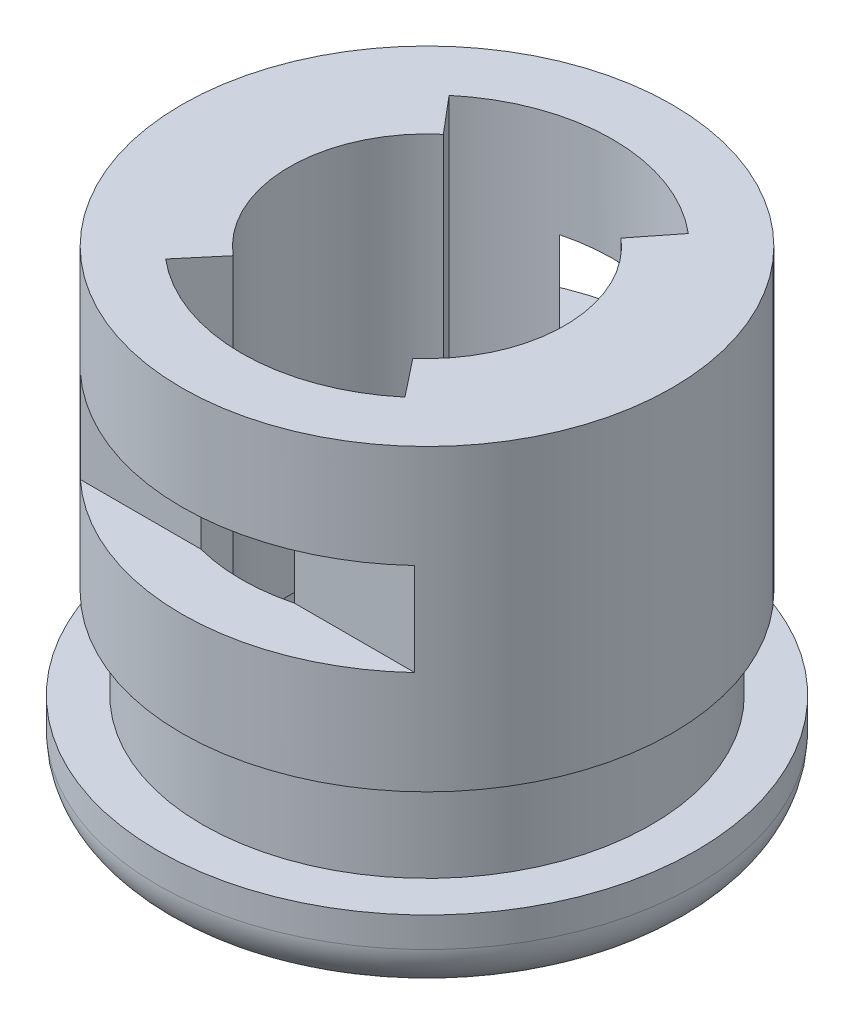
from build123d import *

# Parameters (mm, degrees)
CROQUIS1_R                 = 4.5
SALIENTE_EXTRUIR1_DEPTH    = 1.3
CROQUIS2_R                 = 3.75
SALIENTE_EXTRUIR2_DEPTH    = 1.5
CROQUIS3_R                 = 4.1
SALIENTE_EXTRUIR3_DEPTH    = 5
CORTAR_EXTRUIR3_DEPTH      = 6.2
CORTAR_EXTRUIR4_DEPTH      = 1.8
REDONDEO1_R                = 0.8
CORTAR_EXTRUIR5_DEPTH      = 11.066777041
CORTAR_EXTRUIR5_DEPTH_BACK = 11.066777041
CROQUIS8_W                 = 1.1
CROQUIS8_H                 = 1.55


with BuildPart() as part:
    # Croquis1 → Saliente-Extruir1 (new body)
    with BuildSketch(Plane(origin=(0, 0, 0), x_dir=(1, 0, 0), z_dir=(0, 1, 0))):
        with Locations(Location((0, 0, 0), (0, 0, 270))):
            Circle(CROQUIS1_R)
    extrude(amount=SALIENTE_EXTRUIR1_DEPTH)

    # Croquis2 → Saliente-Extruir2 (add)
    with BuildSketch(Plane(origin=(0, 1.3, 0), x_dir=(1, 0, 0), z_dir=(0, 1, 0))):
        with Locations(Location((0, 0, 0), (0, 0, 270))):
            Circle(CROQUIS2_R)
    extrude(amount=SALIENTE_EXTRUIR2_DEPTH)

    # Croquis3 → Saliente-Extruir3 (add)
    with BuildSketch(Plane(origin=(0, 2.8, 0), x_dir=(1, 0, 0), z_dir=(0, 1, 0))):
        with Locations(Location((0, 0, 0), (0, 0, 270))):
            Circle(CROQUIS3_R)
    extrude(amount=SALIENTE_EXTRUIR3_DEPTH)

    # Croquis4 → Cortar-Extruir3 (cut)
    with BuildSketch(Plane(origin=(0, 7.8, 0), x_dir=(1, 0, 0), z_dir=(0, 1, 0))):
        with BuildLine():
            Line((-2, 2.368543856), (-1.483870968, 1.757306732))
            ThreePointArc((-1.483870968, 1.757306732), (-2.3, 0), (-1.483870968, -1.757306732))
            Line((-1.483870968, -1.757306732), (-2, -2.368543856))
            ThreePointArc((-2, -2.368543856), (0, -3.1), (2, -2.368543856))
            Line((2, -2.368543856), (1.503663664, -1.740400984))
            ThreePointArc((1.503663664, -1.740400984), (2.3, 0), (1.503663664, 1.740400984))
            Line((1.503663664, 1.740400984), (2, 2.368543856))
            ThreePointArc((2, 2.368543856), (0, 3.1), (-2, 2.368543856))
        make_face()
    extrude(amount=-CORTAR_EXTRUIR3_DEPTH, mode=Mode.SUBTRACT)

    # Croquis7 → Cortar-Extruir4 (cut)
    with BuildSketch(Plane(origin=(0, 1.6, 0), x_dir=(1, 0, 0), z_dir=(0, 1, 0))):
        with BuildLine():
            Line((1.642406771, 1.75), (1.642406771, -1.75))
            ThreePointArc((1.642406771, -1.75), (1.157326995, -2.102520922), (0.6, -2.323790008))
            Line((0.6, -2.323790008), (0.6, -3.1))
            Line((0.6, -3.1), (-0.6, -3.1))
            Line((-0.6, -3.1), (-0.6, -2.323790008))
            ThreePointArc((-0.6, -2.323790008), (-2.4, 0), (-0.6, 2.323790008))
            Line((-0.6, 2.323790008), (-0.6, 3.1))
            Line((-0.6, 3.1), (0.6, 3.1))
            Line((0.6, 3.1), (0.6, 2.323790008))
            ThreePointArc((0.6, 2.323790008), (1.157326995, 2.102520922), (1.642406771, 1.75))
        make_face()
    extrude(amount=-CORTAR_EXTRUIR4_DEPTH, mode=Mode.SUBTRACT)

    # Redondeo1
    redondeo1_edges = [part.edges().sort_by_distance(p)[0] for p in [
        (0, 0, -4.5),
    ]]
    fillet(redondeo1_edges, radius=REDONDEO1_R)

    # Croquis8 → Cortar-Extruir5 (cut, two sides: drawn at the far end of the back side and taken through both)
    with BuildSketch(Plane(origin=(0, 0, 0), x_dir=(0, 0, -1), z_dir=(1, 0, 0)).offset(-CORTAR_EXTRUIR5_DEPTH_BACK)):
        with Locations((-3.55, 5.3)):
            Rectangle(CROQUIS8_W, CROQUIS8_H)
        with Locations((3.55, 5.3)):
            Rectangle(CROQUIS8_W, CROQUIS8_H)
    extrude(amount=CORTAR_EXTRUIR5_DEPTH + CORTAR_EXTRUIR5_DEPTH_BACK, mode=Mode.SUBTRACT)


solid = part.part
